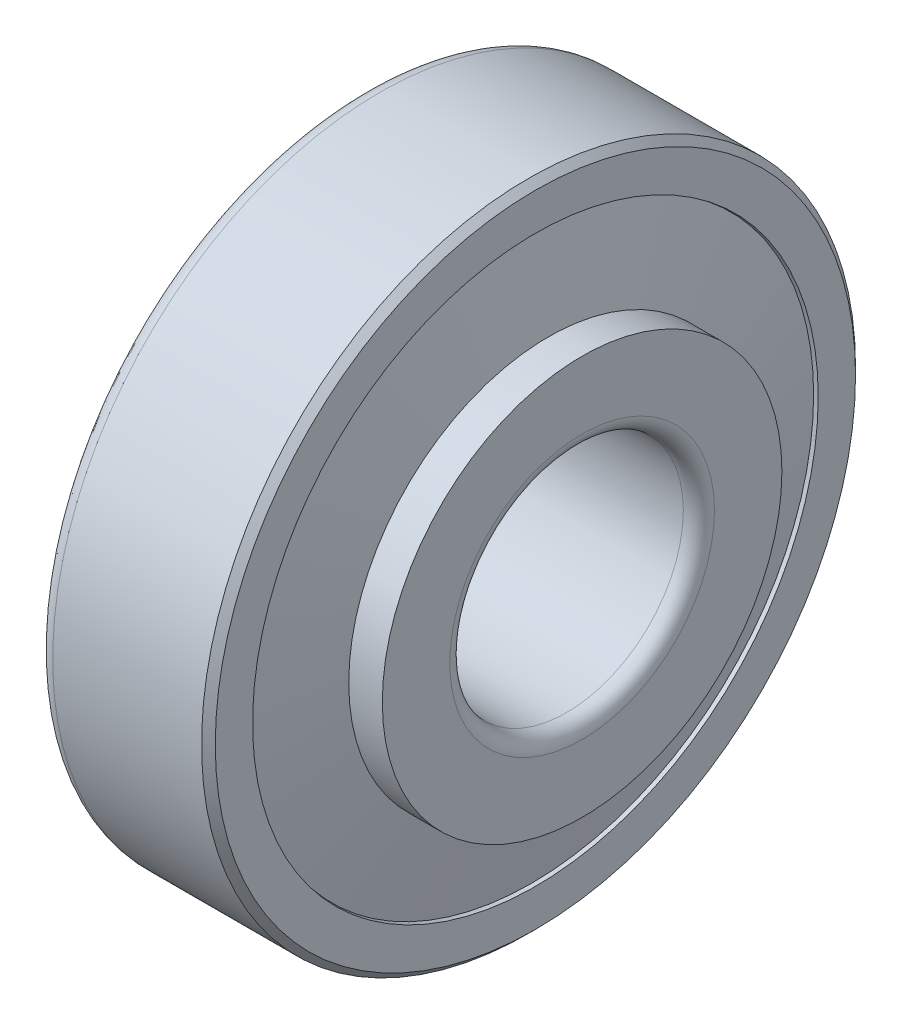
from build123d import *


with BuildPart() as part:
    # OutRacSke → OuterRace (revolve)
    with BuildSketch(Plane.XY):
        with BuildLine():
            Line((-3, 18.164802045), (-14, 16.136))
            Line((-14, 16.136), (-14, 20))
            ThreePointArc((-14, 20), (-13.707106781, 20.707106781), (-13, 21))
            Line((-13, 21), (-3.44, 21))
            Line((-3.44, 21), (-3, 20.56))
            Line((-3, 20.56), (-3, 18.164802045))
        make_face()
    revolve(axis=Axis((-42.5, 0, 0), (1, 0, 0)))

    # RolSimSke → RollersSimplified (revolve)
    with BuildSketch(Plane.XY):
        Polygon((-13, 16.402038732), (-3.26420572, 18.197675036), (-2.162337988, 12.223437637), (-11.898132268, 10.427801333), align=None)
    revolve(axis=Axis((0, 0, 0), (-1, 0, 0)))

    # InsRacSke → InnerRace (revolve)
    with BuildSketch(Plane.XY):
        with BuildLine():
            Line((-11.948645533, 10.731551333), (-13, 10.731551333))
            Line((-13, 10.731551333), (-13, 7.94))
            Line((-13, 7.94), (-12.56, 7.5))
            Line((-12.56, 7.5), (-1, 7.5))
            ThreePointArc((-1, 7.5), (-0.292893219, 7.792893219), (0, 8.5))
            Line((0, 8.5), (0, 12.830937637))
            Line((0, 12.830937637), (-2.156828651, 12.830937637))
            Line((-2.156828651, 12.830937637), (-2.156828651, 12.223437637))
            Line((-2.156828651, 12.223437637), (-11.892622931, 10.427801333))
            Line((-11.892622931, 10.427801333), (-11.948645533, 10.731551333))
        make_face()
    revolve(axis=Axis((-42.5, 0, 0), (1, 0, 0)))


solid = part.part
